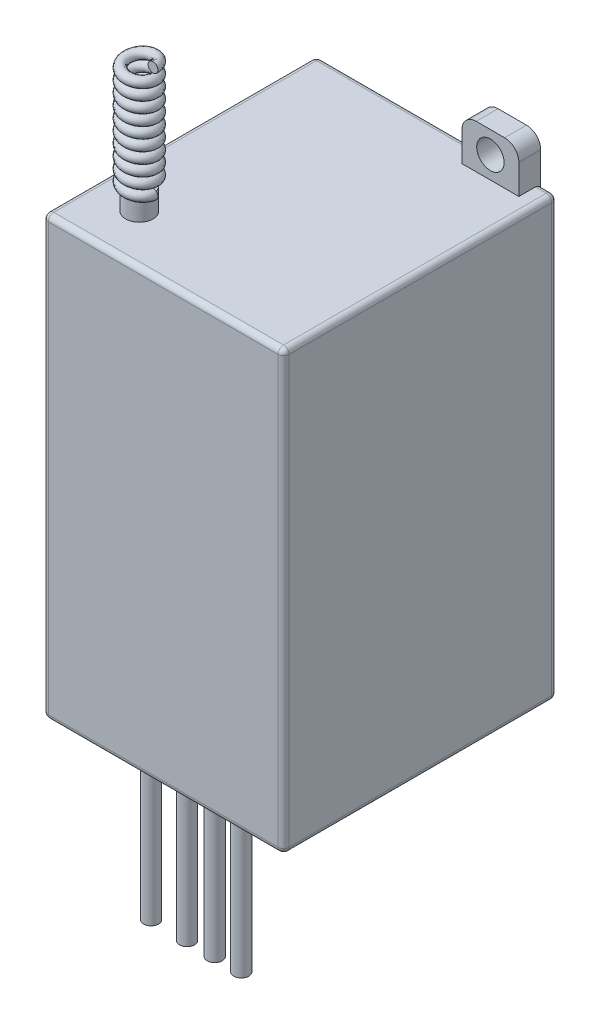
from build123d import *

# Parameters (mm, degrees)
SKETCH1_W           = 22
SKETCH1_H           = 40
BOSS_EXTRUDE1_DEPTH = 25
BODY_FILLETS_R      = 0.5
SKETCH2_R           = 1.25
MOUNTING_TAB_DEPTH  = 2
SKETCH3_R           = 1.25
ANTINA_BASE_DEPTH   = 2
SWEEP1_PITCH        = 1
SWEEP1_HEIGHT       = 10
SWEEP1_RADIUS       = 1.25
SWEEP1_START_ANGLE  = 90
SKETCH5_R           = 0.45
SKETCH6_R           = 0.687530477
BOSS_EXTRUDE4_DEPTH = 15


with BuildPart() as part:
    # Sketch1 → Boss-Extrude1 (new body)
    with BuildSketch(Plane.XY):
        Rectangle(SKETCH1_W, SKETCH1_H)
    extrude(amount=BOSS_EXTRUDE1_DEPTH)

    # Body Fillets
    body_fillets_edges = [part.edges().sort_by_distance(p)[0] for p in [
        (-11, 0, 25),
        (0, -20, 25),
        (11, 0, 25),
        (0, -20, 0),
        (-11, 0, 0),
        (0, 20, 0),
        (11, 0, 0),
        (11, -20, 12.5),
        (-11, -20, 12.5),
        (-11, 20, 12.5),
        (11, 20, 12.5),
        (0, 20, 25),
    ]]
    fillet(body_fillets_edges, radius=BODY_FILLETS_R)

    # Sketch2 → Mounting Tab (add)
    with BuildSketch(Plane.XY):
        with BuildLine():
            Line((9.5, 19.5), (9.5, 22.7))
            ThreePointArc((9.5, 22.7), (9.119238816, 23.619238816), (8.2, 24))
            Line((8.2, 24), (5.6, 24))
            ThreePointArc((5.6, 24), (4.680761184, 23.619238816), (4.3, 22.7))
            Line((4.3, 22.7), (4.3, 19.5))
            Line((4.3, 19.5), (9.5, 19.5))
        make_face()
        with Locations((6.9, 22)):
            Circle(SKETCH2_R, mode=Mode.SUBTRACT)
    extrude(amount=MOUNTING_TAB_DEPTH)

    # Sketch3 → Antina base (add)
    with BuildSketch(Plane(origin=(0, 20, 0), x_dir=(1, 0, 0), z_dir=(0, 1, 0))):
        with Locations(Location((-6.684943785, -20.497623655, 0), (0, 0, 90))):
            Circle(SKETCH3_R)
    extrude(amount=ANTINA_BASE_DEPTH)

    # Sweep1: sweep along a helix
    with BuildLine() as sweep1_path:
        add(Helix(SWEEP1_PITCH, SWEEP1_HEIGHT, SWEEP1_RADIUS, center=(-6.684943785, 22, 20.497623655), direction=(0, 1, 0), lefthand=True, mode=Mode.PRIVATE).rotate(Axis((-6.684943785, 22, 20.497623655), (0, 1, 0)), SWEEP1_START_ANGLE))
    # Sketch5 → Sweep1 (sweep)
    with BuildSketch(Plane.XY.offset(20.497623655)):
        with Locations((-5.434943785, 32)):
            Circle(SKETCH5_R)
    sweep(path=sweep1_path.line, is_frenet=True)

    # Sketch6 → Boss-Extrude4 (add)
    with BuildSketch(Plane.XZ.offset(20)):
        with Locations(Location((-1.773087741, 21.048928225, 0), (0, 0, 90))):
            Circle(SKETCH6_R)
        with Locations(Location((0.755044726, 21.048928225, 0), (0, 0, 90))):
            Circle(SKETCH6_R)
        with Locations(Location((3.1859278, 21.048928225, 0), (0, 0, 90))):
            Circle(SKETCH6_R)
        with Locations(Location((-5.062890332, 21.048928225, 0), (0, 0, 90))):
            Circle(SKETCH6_R)
    extrude(amount=BOSS_EXTRUDE4_DEPTH)


solid = part.part
